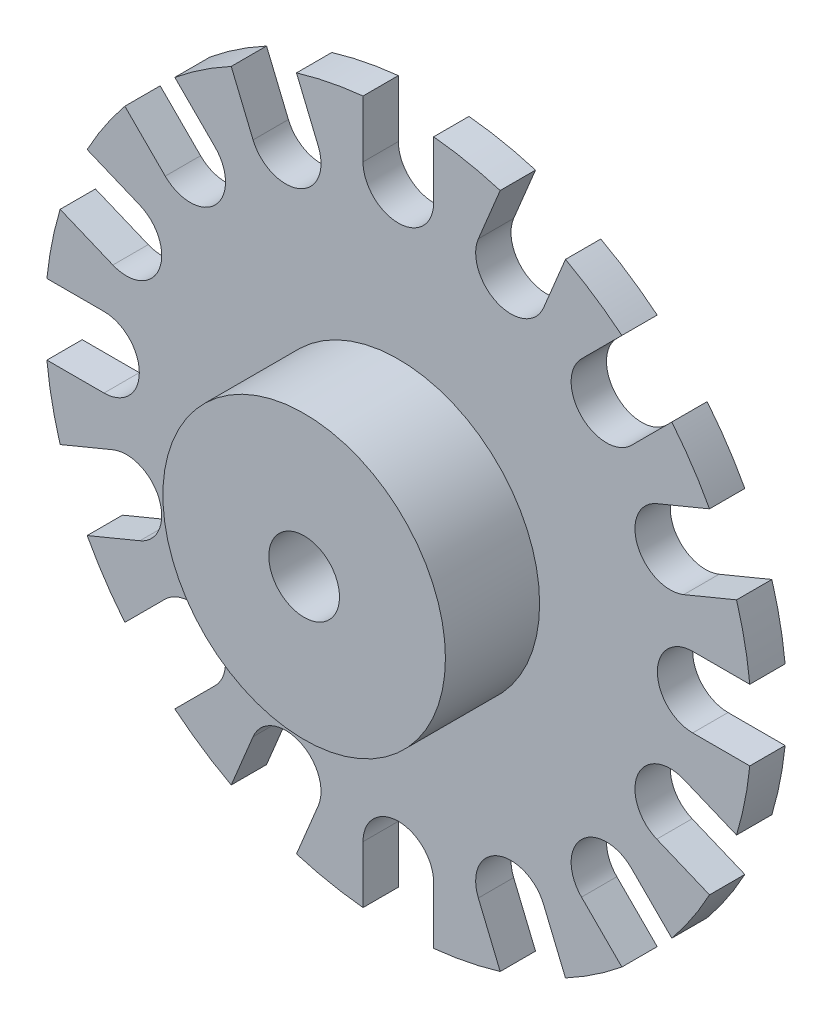
from build123d import *

# Parameters (mm, degrees)
SKETCH1_R           = 15
SKETCH1_R_2         = 1.5
BOSS_EXTRUDE1_DEPTH = 1.5
SKETCH2_R           = 6
SKETCH2_R_2         = 1.5
BOSS_EXTRUDE2_DEPTH = 4
CUT_EXTRUDE3_DEPTH  = 22.587033145


with BuildPart() as part:
    # Sketch1 → Boss-Extrude1 (new body)
    with BuildSketch(Plane.XY):
        Circle(SKETCH1_R)
        Circle(SKETCH1_R_2, mode=Mode.SUBTRACT)
    extrude(amount=BOSS_EXTRUDE1_DEPTH)

    # Sketch2 → Boss-Extrude2 (add)
    with BuildSketch(Plane.XY.offset(1.5)):
        Circle(SKETCH2_R)
        Circle(SKETCH2_R_2, mode=Mode.SUBTRACT)
    extrude(amount=BOSS_EXTRUDE2_DEPTH)

    # Sketch3 → Cut-Extrude3 (cut, through all)
    with BuildSketch(Plane.XY.offset(1.5)):
        with BuildLine():
            Line((-1.5, 14.924811557), (-1.5, 12.5))
            ThreePointArc((-1.5, 12.5), (0, 11), (1.5, 12.5))
            Line((1.5, 12.5), (1.5, 14.924811557))
            ThreePointArc((1.5, 14.924811557), (0, 15), (-1.5, 14.924811557))
        make_face()
        with BuildLine():
            ThreePointArc((7.097297413, 13.214702775), (5.740251485, 13.858192988), (4.325658815, 14.362753072))
            Line((4.325658815, 14.362753072), (3.397723606, 12.122519305))
            ThreePointArc((3.397723606, 12.122519305), (4.209517756, 10.162674858), (6.169362203, 10.974469008))
            Line((6.169362203, 10.974469008), (7.097297413, 13.214702775))
        make_face()
        with BuildLine():
            Line((-3.397723606, 12.122519305), (-4.325658815, 14.362753072))
            ThreePointArc((-4.325658815, 14.362753072), (-5.740251485, 13.858192988), (-7.097297413, 13.214702775))
            Line((-7.097297413, 13.214702775), (-6.169362203, 10.974469008))
            ThreePointArc((-6.169362203, 10.974469008), (-4.209517756, 10.162674858), (-3.397723606, 12.122519305))
        make_face()
        with BuildLine():
            ThreePointArc((11.614095631, 9.492775288), (10.606601718, 10.606601718), (9.492775288, 11.614095631))
            Line((9.492775288, 11.614095631), (7.778174593, 9.899494937))
            ThreePointArc((7.778174593, 9.899494937), (7.778174593, 7.778174593), (9.899494937, 7.778174593))
            Line((9.899494937, 7.778174593), (11.614095631, 9.492775288))
        make_face()
        with BuildLine():
            Line((-7.778174593, 9.899494937), (-9.492775288, 11.614095631))
            ThreePointArc((-9.492775288, 11.614095631), (-10.606601718, 10.606601718), (-11.614095631, 9.492775288))
            Line((-11.614095631, 9.492775288), (-9.899494937, 7.778174593))
            ThreePointArc((-9.899494937, 7.778174593), (-7.778174593, 7.778174593), (-7.778174593, 9.899494937))
        make_face()
        with BuildLine():
            ThreePointArc((14.362753072, 4.325658815), (13.858192988, 5.740251485), (13.214702775, 7.097297413))
            Line((13.214702775, 7.097297413), (10.974469008, 6.169362203))
            ThreePointArc((10.974469008, 6.169362203), (10.162674858, 4.209517756), (12.122519305, 3.397723606))
            Line((12.122519305, 3.397723606), (14.362753072, 4.325658815))
        make_face()
        with BuildLine():
            Line((-10.974469008, 6.169362203), (-13.214702775, 7.097297413))
            ThreePointArc((-13.214702775, 7.097297413), (-13.858192988, 5.740251485), (-14.362753072, 4.325658815))
            Line((-14.362753072, 4.325658815), (-12.122519305, 3.397723606))
            ThreePointArc((-12.122519305, 3.397723606), (-10.162674858, 4.209517756), (-10.974469008, 6.169362203))
        make_face()
        with BuildLine():
            Line((14.924811557, 1.5), (12.5, 1.5))
            ThreePointArc((12.5, 1.5), (11, 0), (12.5, -1.5))
            Line((12.5, -1.5), (14.924811557, -1.5))
            ThreePointArc((14.924811557, -1.5), (15, 0), (14.924811557, 1.5))
        make_face()
        with BuildLine():
            Line((-12.5, 1.5), (-14.924811557, 1.5))
            ThreePointArc((-14.924811557, 1.5), (-15, 0), (-14.924811557, -1.5))
            Line((-14.924811557, -1.5), (-12.5, -1.5))
            ThreePointArc((-12.5, -1.5), (-11, 0), (-12.5, 1.5))
        make_face()
        with BuildLine():
            ThreePointArc((13.214702775, -7.097297413), (13.858192988, -5.740251485), (14.362753072, -4.325658815))
            Line((14.362753072, -4.325658815), (12.122519305, -3.397723606))
            ThreePointArc((12.122519305, -3.397723606), (10.162674858, -4.209517756), (10.974469008, -6.169362203))
            Line((10.974469008, -6.169362203), (13.214702775, -7.097297413))
        make_face()
        with BuildLine():
            Line((-12.122519305, -3.397723606), (-14.362753072, -4.325658815))
            ThreePointArc((-14.362753072, -4.325658815), (-13.858192988, -5.740251485), (-13.214702775, -7.097297413))
            Line((-13.214702775, -7.097297413), (-10.974469008, -6.169362203))
            ThreePointArc((-10.974469008, -6.169362203), (-10.162674858, -4.209517756), (-12.122519305, -3.397723606))
        make_face()
        with BuildLine():
            ThreePointArc((9.492775288, -11.614095631), (10.606601718, -10.606601718), (11.614095631, -9.492775288))
            Line((11.614095631, -9.492775288), (9.899494937, -7.778174593))
            ThreePointArc((9.899494937, -7.778174593), (7.778174593, -7.778174593), (7.778174593, -9.899494937))
            Line((7.778174593, -9.899494937), (9.492775288, -11.614095631))
        make_face()
        with BuildLine():
            Line((-9.899494937, -7.778174593), (-11.614095631, -9.492775288))
            ThreePointArc((-11.614095631, -9.492775288), (-10.606601718, -10.606601718), (-9.492775288, -11.614095631))
            Line((-9.492775288, -11.614095631), (-7.778174593, -9.899494937))
            ThreePointArc((-7.778174593, -9.899494937), (-7.778174593, -7.778174593), (-9.899494937, -7.778174593))
        make_face()
        with BuildLine():
            ThreePointArc((4.325658815, -14.362753072), (5.740251485, -13.858192988), (7.097297413, -13.214702775))
            Line((7.097297413, -13.214702775), (6.169362203, -10.974469008))
            ThreePointArc((6.169362203, -10.974469008), (4.209517756, -10.162674858), (3.397723606, -12.122519305))
            Line((3.397723606, -12.122519305), (4.325658815, -14.362753072))
        make_face()
        with BuildLine():
            Line((-6.169362203, -10.974469008), (-7.097297413, -13.214702775))
            ThreePointArc((-7.097297413, -13.214702775), (-5.740251485, -13.858192988), (-4.325658815, -14.362753072))
            Line((-4.325658815, -14.362753072), (-3.397723606, -12.122519305))
            ThreePointArc((-3.397723606, -12.122519305), (-4.209517756, -10.162674858), (-6.169362203, -10.974469008))
        make_face()
        with BuildLine():
            ThreePointArc((-1.5, -14.924811557), (0, -15), (1.5, -14.924811557))
            Line((1.5, -14.924811557), (1.5, -12.5))
            ThreePointArc((1.5, -12.5), (0, -11), (-1.5, -12.5))
            Line((-1.5, -12.5), (-1.5, -14.924811557))
        make_face()
    extrude(amount=-CUT_EXTRUDE3_DEPTH, mode=Mode.SUBTRACT)


solid = part.part
